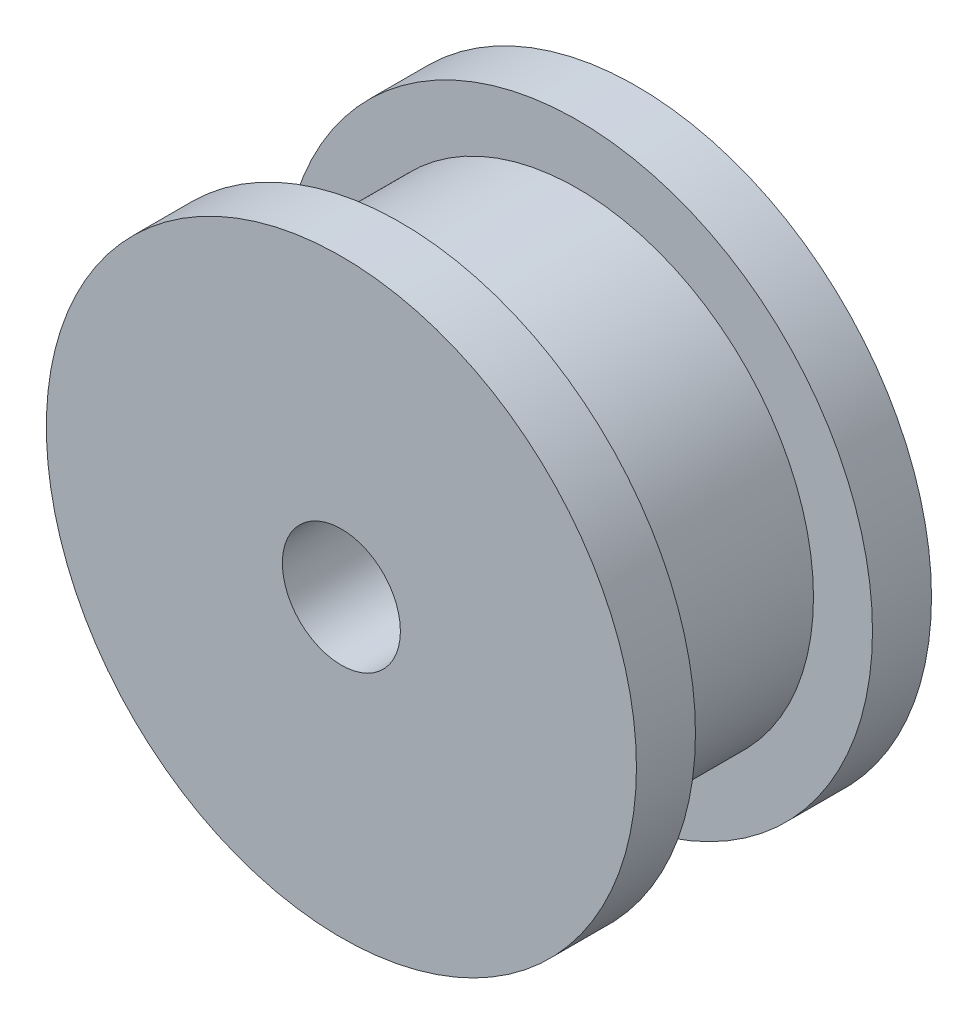
from build123d import *

# Parameters (mm, degrees)
SKETCH_1_R               = 50
EXTRUDE_1_DEPTH          = 50
CUT_EXTRUDE_1_DEPTH      = 15
CUT_EXTRUDE_1_DEPTH_BACK = 15
SKETCH_2_OUTSIDE_W       = 132
SKETCH_2_OUTSIDE_H       = 132
SKETCH_2_OUTSIDE_R       = 40
CUT_EXTRUDE_2_DEPTH      = 76
CUT_EXTRUDE_2_DEPTH_BACK = 76
SKETCH_3_R               = 10


with BuildPart() as part:
    # 草图1 → 凸台-拉伸1 (new body)
    with BuildSketch(Plane.XY):
        Circle(SKETCH_1_R)
    extrude(amount=EXTRUDE_1_DEPTH)

    # 草图2 outside → 切除-拉伸1 (cut, two sides: drawn at the far end of the back side and taken through both)
    with BuildSketch(Plane.XY.offset(25).offset(-CUT_EXTRUDE_1_DEPTH_BACK)):
        Rectangle(SKETCH_2_OUTSIDE_W, SKETCH_2_OUTSIDE_H)
        Circle(SKETCH_2_OUTSIDE_R, mode=Mode.SUBTRACT)
    extrude(amount=CUT_EXTRUDE_1_DEPTH + CUT_EXTRUDE_1_DEPTH_BACK, mode=Mode.SUBTRACT)

    # 草图3 → 切除-拉伸2 (cut, two sides: drawn at the far end of the back side and taken through both)
    with BuildSketch(Plane.XY.offset(25).offset(-CUT_EXTRUDE_2_DEPTH_BACK)):
        Circle(SKETCH_3_R)
    extrude(amount=CUT_EXTRUDE_2_DEPTH + CUT_EXTRUDE_2_DEPTH_BACK, mode=Mode.SUBTRACT)


solid = part.part
